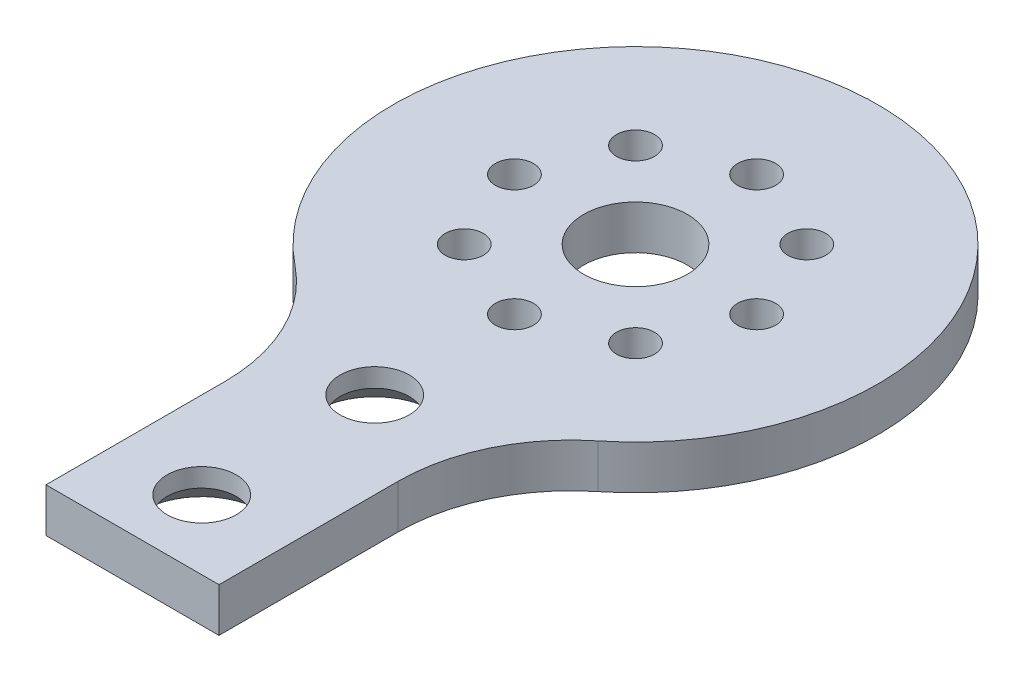
from build123d import *

# Parameters (mm, degrees)
BOSS_EXTRUDE1_DEPTH                            = 6.35
M5_CLEARANCE_HOLE1_D                           = 5.5
M5_CLEARANCE_HOLE1_CSINK_D                     = 5.55
M5_CLEARANCE_HOLE1_CSINK_ANGLE                 = 90
SKETCH5_R                                      = 7.5
CUT_EXTRUDE1_DEPTH                             = 81.928436696
CSK_FOR_M8_FLAT_HEAD_MACHINE_SCREW1_AT_2_COUNT = 2
CSK_FOR_M8_FLAT_HEAD_MACHINE_SCREW1_AT_2_PITCH = 25
FILLET1_R                                      = 25


with BuildPart() as part:
    # Sketch1 → Boss-Extrude1 (new body)
    with BuildSketch(Plane(origin=(0, 0, 0), x_dir=(1, 0, 0), z_dir=(0, 1, 0))):
        with BuildLine():
            Line((-12.5, -72.691742077), (12.5, -72.691742077))
            Line((12.5, -72.691742077), (12.5, -32.691742077))
            ThreePointArc((12.5, -32.691742077), (0, 35), (-12.5, -32.691742077))
            Line((-12.5, -32.691742077), (-12.5, -72.691742077))
        make_face()
    extrude(amount=BOSS_EXTRUDE1_DEPTH)

    # M5 Clearance Hole1 (through all)
    with Locations(Plane(origin=(0, 0, 0), x_dir=(-1, 0, 0), z_dir=(0, -1, 0))):
        with Locations((0, 17.5), (12.374368671, 12.374368671), (17.5, 0), (12.374368671, -12.374368671), (0, -17.5), (-12.374368671, -12.374368671), (-17.5, 0), (-12.374368671, 12.374368671)):
            CounterSinkHole(M5_CLEARANCE_HOLE1_D / 2, M5_CLEARANCE_HOLE1_CSINK_D / 2, counter_sink_angle=M5_CLEARANCE_HOLE1_CSINK_ANGLE)

    # Sketch5 → Cut-Extrude1 (cut, through all)
    with BuildSketch(Plane.XZ):
        with Locations(Location((0, 0, 0), (0, 0, 270))):
            Circle(SKETCH5_R)
    extrude(amount=-CUT_EXTRUDE1_DEPTH, mode=Mode.SUBTRACT)

    # Sketch8 → CSK for M8 Flat Head Machine Screw1 (revolve, cut)
    with BuildSketch(Plane(origin=(0, 0, 37.691742077), x_dir=(0, 0, -1), z_dir=(1, 0, 0))):
        Polygon((0, 0), (0, 6.35), (5, 6.35), (5, 3.65), (8.65, 0), align=None)
    csk_for_m8_flat_head_machine_screw1 = revolve(axis=Axis((0, -6.35, 37.691742077), (0, 1, 0)), mode=Mode.SUBTRACT)

    # CSK for M8 Flat Head Machine Screw1 at 2: CSK for M8 Flat Head Machine Screw1 ×2
    with Locations(*[(0, 0, i * CSK_FOR_M8_FLAT_HEAD_MACHINE_SCREW1_AT_2_PITCH) for i in range(1, CSK_FOR_M8_FLAT_HEAD_MACHINE_SCREW1_AT_2_COUNT)]):
        add(csk_for_m8_flat_head_machine_screw1, mode=Mode.SUBTRACT)

    # Fillet1
    fillet1_edges = [part.edges().sort_by_distance(p)[0] for p in [
        (-12.5, 3.175, 32.691742077),
        (12.5, 3.175, 32.691742077),
    ]]
    fillet(fillet1_edges, radius=FILLET1_R)


solid = part.part
